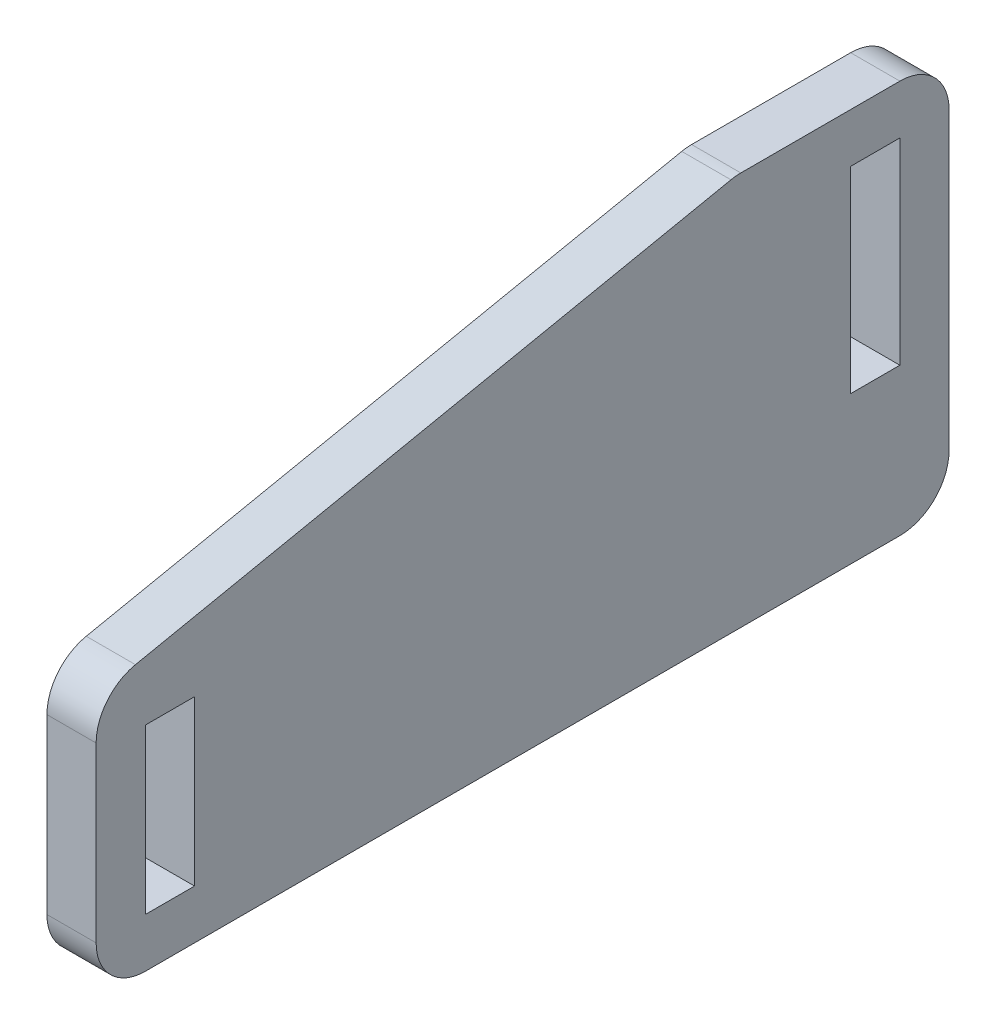
from build123d import *

# Parameters (mm, degrees)
SKETCH_1_W      = 3
SKETCH_1_H      = 10
SKETCH_1_H_2    = 12
EXTRUDE_1_DEPTH = 3
FILLET_1_R      = 3


with BuildPart() as part:
    # Эскиз1 → Бобышка-Вытянуть1 (new body)
    with BuildSketch(Plane(origin=(0, 0, 0), x_dir=(0, 0, -1), z_dir=(1, 0, 0))):
        Polygon((-26, 4), (13, 12), (26, 12), (26, -12), (-26, -12), align=None)
        with Locations((-21.5, -4)):
            Rectangle(SKETCH_1_W, SKETCH_1_H, mode=Mode.SUBTRACT)
        with Locations((21.5, 3)):
            Rectangle(SKETCH_1_W, SKETCH_1_H_2, mode=Mode.SUBTRACT)
    extrude(amount=EXTRUDE_1_DEPTH)

    # Скругление1
    fillet_1_edges = [part.edges().sort_by_distance(p)[0] for p in [
        (1.5, 4, 26),
        (1.5, 12, -13),
        (1.5, 12, -26),
        (1.5, -12, -26),
        (1.5, -12, 26),
    ]]
    fillet(fillet_1_edges, radius=FILLET_1_R)


solid = part.part
